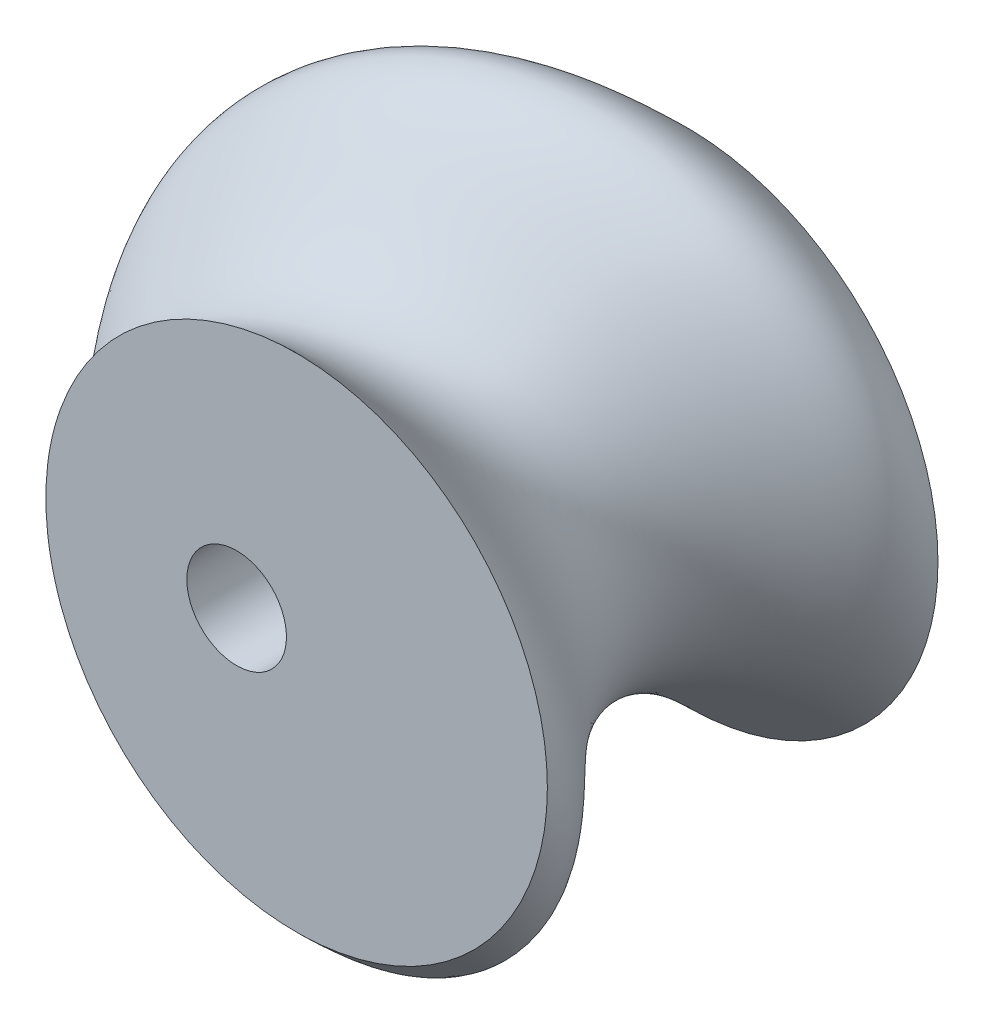
from build123d import *

# Parameters (mm, degrees)
AUSTRAGUNG1_PITCH               = 20
AUSTRAGUNG1_HEIGHT              = 20
AUSTRAGUNG1_RADIUS              = 2.55
SKIZZE2_R                       = 12.84
SKIZZE3_2_R                     = 2.55
SCHNITT_LINEAR_AUSTRAGEN2_DEPTH = 27


with BuildPart() as part:
    # Austragung1: sweep along a helix
    with BuildLine() as austragung1_path:
        Helix(AUSTRAGUNG1_PITCH, AUSTRAGUNG1_HEIGHT, AUSTRAGUNG1_RADIUS, center=(-3.071, 0, 0), direction=(0, 0, 1))
    # Skizze2 → Austragung1 (sweep)
    with BuildSketch(Plane.XY):
        Circle(SKIZZE2_R)
    sweep(path=austragung1_path.line, is_frenet=True)

    # Skizze3<2> → Schnitt-Linear austragen2 (cut)
    with BuildSketch(Plane.XY):
        with Locations(Location((-3.071, 0, 0), (0, 0, 180))):
            Circle(SKIZZE3_2_R)
    extrude(amount=SCHNITT_LINEAR_AUSTRAGEN2_DEPTH, mode=Mode.SUBTRACT)


solid = part.part
